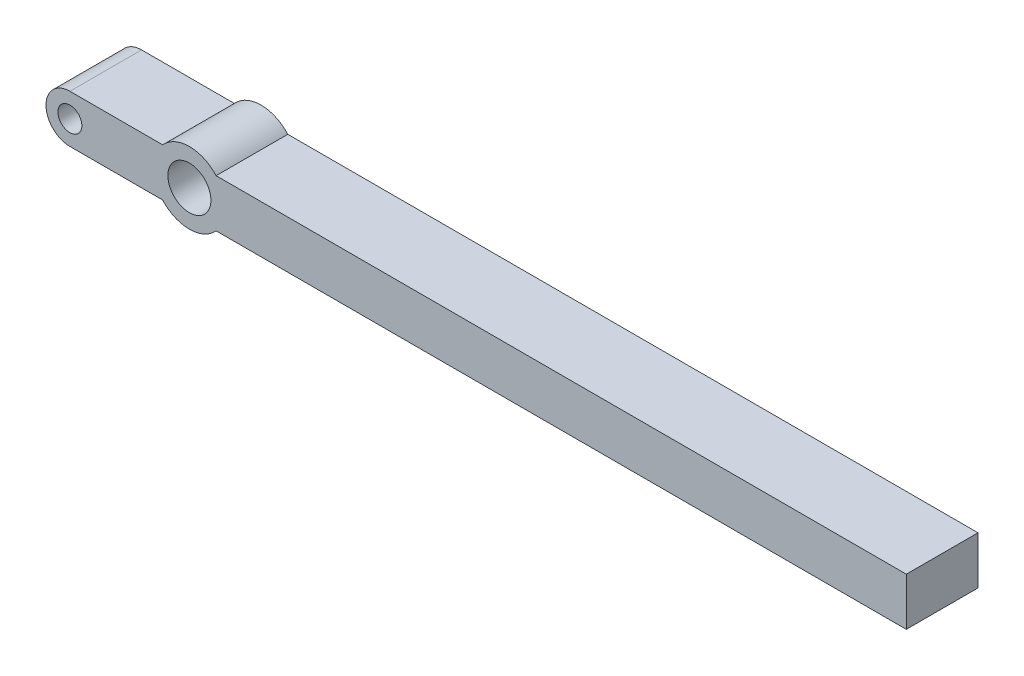
from build123d import *

# Parameters (mm, degrees)
BOSS_EXTRUDE1_DEPTH      = 15
BOSS_EXTRUDE1_DEPTH_BACK = 15
SKETCH1_R                = 9
SKETCH1_R_2              = 5


with BuildPart() as part:
    # Sketch1 → Boss-Extrude1 (new, two sides: drawn at the far end of the back side and taken through both)
    with BuildSketch(Plane.XY.offset(-BOSS_EXTRUDE1_DEPTH_BACK)):
        with BuildLine():
            Line((282.195121951, 33.780487805), (-6.624538161, 33.780487805))
            ThreePointArc((-6.624538161, 33.780487805), (-17.804878049, 38.780487805), (-28.985217936, 33.780487805))
            Line((-28.985217936, 33.780487805), (-67.804878049, 33.780487805))
            ThreePointArc((-67.804878049, 33.780487805), (-77.804878049, 23.780487805), (-67.804878049, 13.780487805))
            Line((-67.804878049, 13.780487805), (-28.985217936, 13.780487805))
            ThreePointArc((-28.985217936, 13.780487805), (-17.804878049, 8.780487805), (-6.624538161, 13.780487805))
            Line((-6.624538161, 13.780487805), (282.195121951, 13.780487805))
            Line((282.195121951, 13.780487805), (282.195121951, 33.780487805))
        make_face()
        with Locations((-17.804878049, 23.780487805)):
            Circle(SKETCH1_R, mode=Mode.SUBTRACT)
        with Locations((-67.804878049, 23.780487805)):
            Circle(SKETCH1_R_2, mode=Mode.SUBTRACT)
    extrude(amount=BOSS_EXTRUDE1_DEPTH + BOSS_EXTRUDE1_DEPTH_BACK)


solid = part.part
